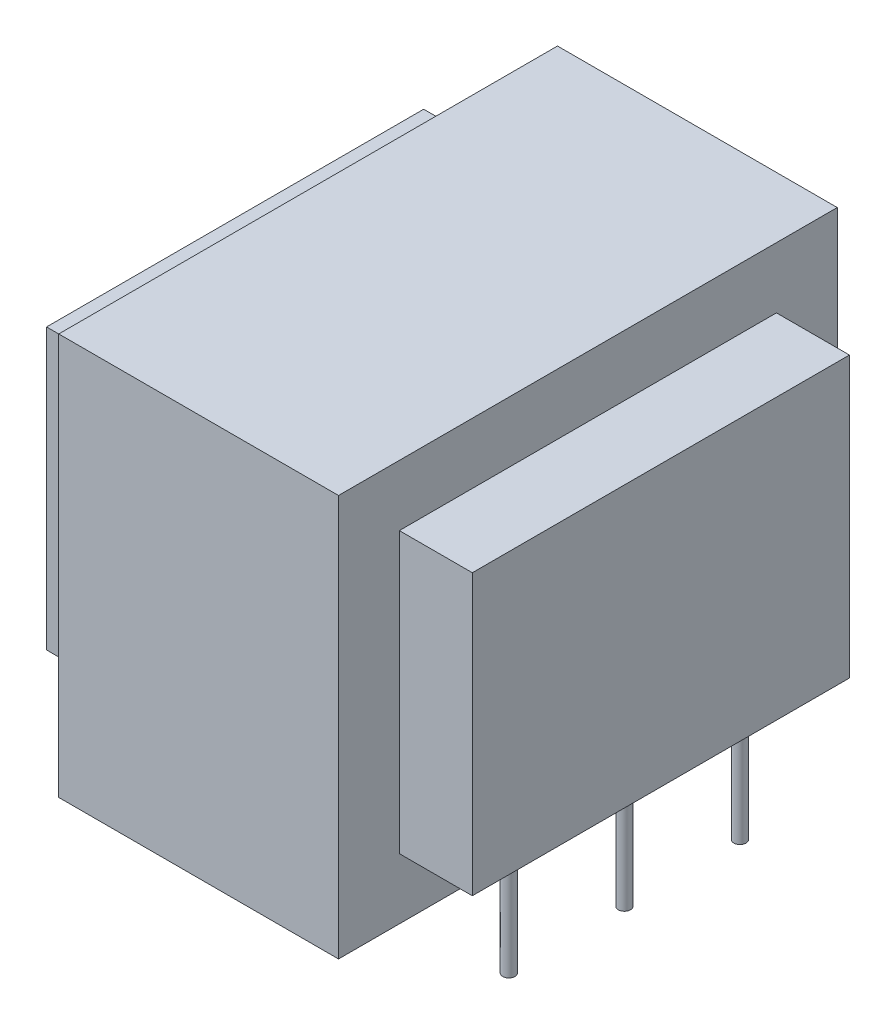
from build123d import *

# Parameters (mm, degrees)
SKETCH_1_W          = 35
SKETCH_1_H          = 41
EXTRUDE_1_DEPTH     = 33
SKETCH_3_W          = 41
SKETCH_3_H          = 33
SKETCH_3_W_2        = 31
SKETCH_3_H_2        = 23
CUT_EXTRUDE_1_DEPTH = 6
SKETCH_2_R          = 0.5
EXTRUDE_2_DEPTH     = 10


with BuildPart() as part:
    # 草图1 → 凸台-拉伸1 (new body)
    with BuildSketch(Plane(origin=(0, 0, 0), x_dir=(1, 0, 0), z_dir=(0, 1, 0))):
        with Locations((17.5, 20.5)):
            Rectangle(SKETCH_1_W, SKETCH_1_H)
    extrude(amount=EXTRUDE_1_DEPTH)

    # 草图3 → 切除-拉伸1 (cut)
    with BuildSketch(Plane(origin=(35, 0, 0), x_dir=(0, 0, -1), z_dir=(1, 0, 0))):
        with Locations((20.5, 16.5)):
            Rectangle(SKETCH_3_W, SKETCH_3_H)
        with Locations((20.5, 16.5)):
            Rectangle(SKETCH_3_W_2, SKETCH_3_H_2, mode=Mode.SUBTRACT)
    cut_extrude_1 = extrude(amount=-CUT_EXTRUDE_1_DEPTH, mode=Mode.SUBTRACT)

    # 镜向9: 切除-拉伸1 across plane
    add(cut_extrude_1.mirror(Plane(origin=(17.5, 0, 0), x_dir=(0, 0, 1), z_dir=(1, 0, 0))), mode=Mode.SUBTRACT)

    # 草图2 → 凸台-拉伸2 (add)
    with BuildSketch(Plane.XZ.offset(-5)):
        with Locations(Location((3, -11, 0), (0, 0, 90))):
            Circle(SKETCH_2_R)
        with Locations(Location((3, -30, 0), (0, 0, 90))):
            Circle(SKETCH_2_R)
        with Locations(Location((32, -30, 0), (0, 0, 270))):
            Circle(SKETCH_2_R)
        with Locations(Location((32, -11, 0), (0, 0, 90))):
            Circle(SKETCH_2_R)
        with Locations(Location((32, -20.5, 0), (0, 0, 90))):
            Circle(SKETCH_2_R)
    extrude(amount=EXTRUDE_2_DEPTH)


solid = part.part
